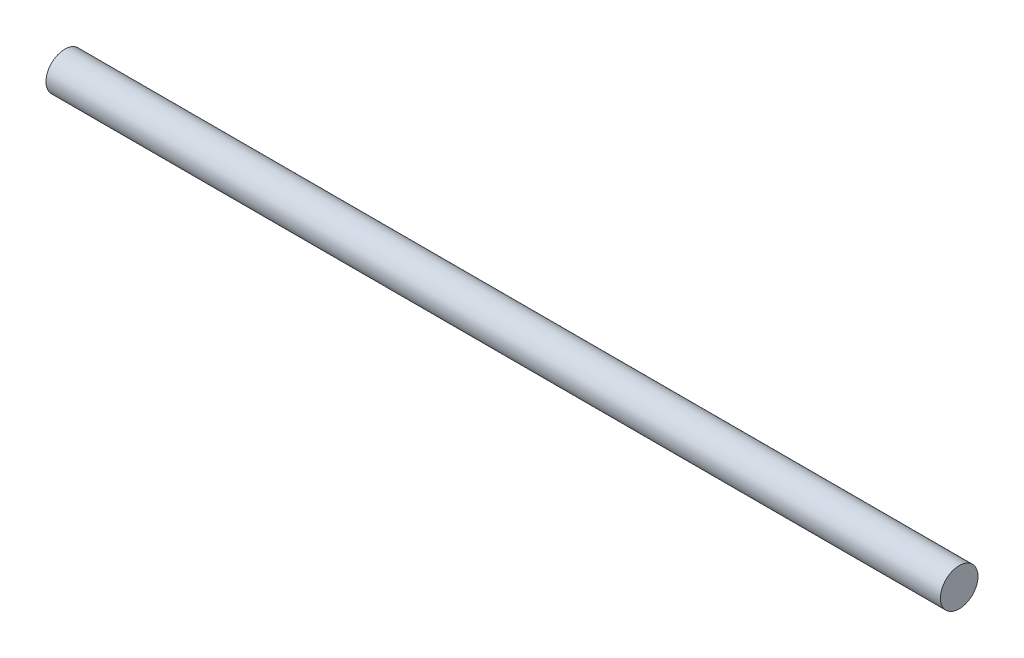
from build123d import *

# Parameters (mm, degrees)
SKETCH1_R           = 1.25
BOSS_EXTRUDE1_DEPTH = 59.5


with BuildPart() as part:
    # Sketch1 → Boss-Extrude1 (new body)
    with BuildSketch(Plane(origin=(0, 0, 0), x_dir=(0, 0, -1), z_dir=(1, 0, 0))):
        Circle(SKETCH1_R)
    extrude(amount=BOSS_EXTRUDE1_DEPTH)


solid = part.part
